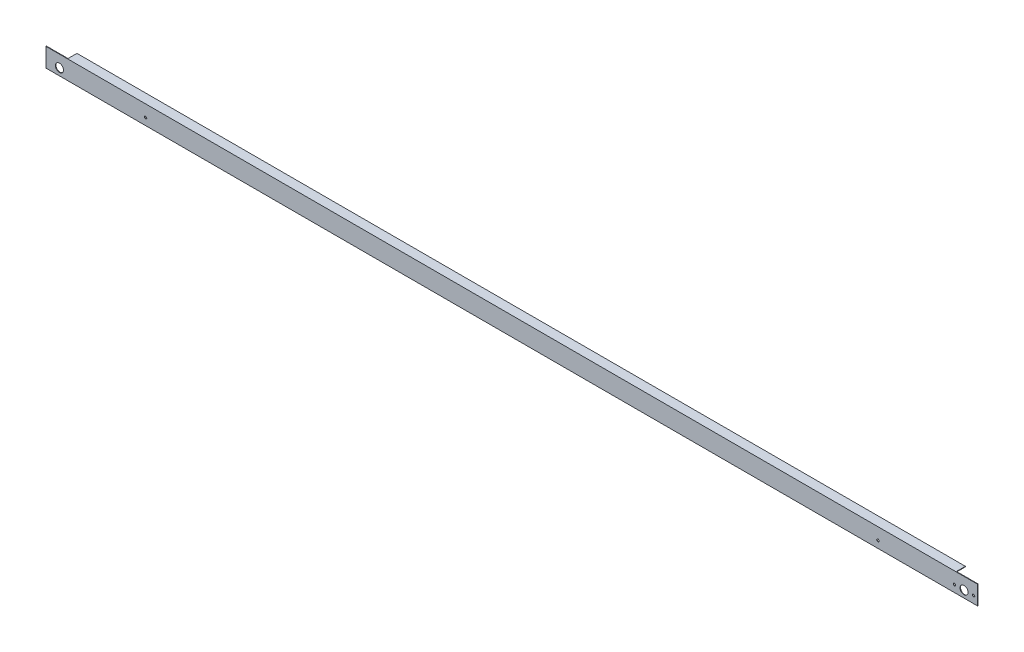
from build123d import *

# Parameters (mm, degrees)
BOSS_EXTRUDE1_DEPTH = 4394.2
CUT_EXTRUDE1_REACH  = 4396.86
SKETCH2_R           = 19.05
SKETCH2_R_2         = 5.55625
CUT_EXTRUDE4_REACH  = 4396.86
SKETCH3_W           = 101.6
SKETCH3_H           = 2.38125
SKETCH4_R           = 5.588
SKETCH4_R_2         = 19.05
CUT_EXTRUDE5_DEPTH  = 2.38125


with BuildPart() as part:
    # Sketch1 → Boss-Extrude1 (new body)
    with BuildSketch(Plane(origin=(0, 0, 0), x_dir=(0, 0, -1), z_dir=(1, 0, 0))):
        Polygon((0, 0), (0, 63.5), (44.45, 63.5), (44.45, 61.11875), (2.38125, 61.11875), (2.38125, 0), (2.38125, -25.4), (0, -25.4), align=None)
    extrude(amount=BOSS_EXTRUDE1_DEPTH)

    # Sketch2 → Cut-Extrude1 (cut, up to next)
    with BuildSketch(Plane(origin=(0, 0, -2.38125), x_dir=(-1, 0, 0), z_dir=(0, 0, -1)), mode=Mode.PRIVATE) as cut_extrude1_sk1:
        with Locations((-4330.7, 7.62)):
            Circle(SKETCH2_R)
    cut_extrude1_tool1 = extrude(cut_extrude1_sk1.sketch, amount=-CUT_EXTRUDE1_REACH, mode=Mode.PRIVATE) & part.part
    # Sketch2 → Cut-Extrude1 (cut, up to next)
    with BuildSketch(Plane(origin=(0, 0, -2.38125), x_dir=(-1, 0, 0), z_dir=(0, 0, -1)), mode=Mode.PRIVATE) as cut_extrude1_sk2:
        with Locations((-63.5, 7.62)):
            Circle(SKETCH2_R)
    cut_extrude1_tool2 = extrude(cut_extrude1_sk2.sketch, amount=-CUT_EXTRUDE1_REACH, mode=Mode.PRIVATE) & part.part
    # Sketch2 → Cut-Extrude1 (cut, up to next)
    with BuildSketch(Plane(origin=(0, 0, -2.38125), x_dir=(-1, 0, 0), z_dir=(0, 0, -1)), mode=Mode.PRIVATE) as cut_extrude1_sk3:
        with Locations((-4285.6546875, 7.62)):
            Circle(SKETCH2_R_2)
    cut_extrude1_tool3 = extrude(cut_extrude1_sk3.sketch, amount=-CUT_EXTRUDE1_REACH, mode=Mode.PRIVATE) & part.part
    # Sketch2 → Cut-Extrude1 (cut, up to next)
    with BuildSketch(Plane(origin=(0, 0, -2.38125), x_dir=(-1, 0, 0), z_dir=(0, 0, -1)), mode=Mode.PRIVATE) as cut_extrude1_sk4:
        with Locations((-4375.7453125, 7.62)):
            Circle(SKETCH2_R_2)
    cut_extrude1_tool4 = extrude(cut_extrude1_sk4.sketch, amount=-CUT_EXTRUDE1_REACH, mode=Mode.PRIVATE) & part.part
    add(cut_extrude1_tool1.solids().sort_by_distance((4330.7, 7.62, -2.38125))[0], mode=Mode.SUBTRACT)
    add(cut_extrude1_tool2.solids().sort_by_distance((63.5, 7.62, -2.38125))[0], mode=Mode.SUBTRACT)
    add(cut_extrude1_tool3.solids().sort_by_distance((4285.654687, 7.62, -2.38125))[0], mode=Mode.SUBTRACT)
    add(cut_extrude1_tool4.solids().sort_by_distance((4375.745312, 7.62, -2.38125))[0], mode=Mode.SUBTRACT)

    # Sketch3 → Cut-Extrude4 (cut, up to next)
    with BuildSketch(Plane(origin=(0, 0, -2.38125), x_dir=(-1, 0, 0), z_dir=(0, 0, -1)), mode=Mode.PRIVATE) as cut_extrude4_sk1:
        with Locations((-4343.4, 62.309375)):
            Rectangle(SKETCH3_W, SKETCH3_H)
    cut_extrude4_tool1 = extrude(cut_extrude4_sk1.sketch, amount=CUT_EXTRUDE4_REACH, mode=Mode.PRIVATE) & part.part
    # Sketch3 → Cut-Extrude4 (cut, up to next)
    with BuildSketch(Plane(origin=(0, 0, -2.38125), x_dir=(-1, 0, 0), z_dir=(0, 0, -1)), mode=Mode.PRIVATE) as cut_extrude4_sk2:
        with Locations((-50.8, 62.309375)):
            Rectangle(SKETCH3_W, SKETCH3_H)
    cut_extrude4_tool2 = extrude(cut_extrude4_sk2.sketch, amount=CUT_EXTRUDE4_REACH, mode=Mode.PRIVATE) & part.part
    add(cut_extrude4_tool1.solids().sort_by_distance((4343.4, 62.309375, -2.38125))[0], mode=Mode.SUBTRACT)
    add(cut_extrude4_tool2.solids().sort_by_distance((50.8, 62.309375, -2.38125))[0], mode=Mode.SUBTRACT)

    # Sketch4 → Cut-Extrude5 (cut)
    with BuildSketch(Plane(origin=(0, 0, -2.38125), x_dir=(-1, 0, 0), z_dir=(0, 0, -1))):
        with Locations((-3924.3, 7.62)):
            Circle(SKETCH4_R)
        with Locations((-469.9, 7.62)):
            Circle(SKETCH4_R)
        with Locations((-63.5, 7.62)):
            Circle(SKETCH4_R_2)
    extrude(amount=-CUT_EXTRUDE5_DEPTH, mode=Mode.SUBTRACT)


solid = part.part
